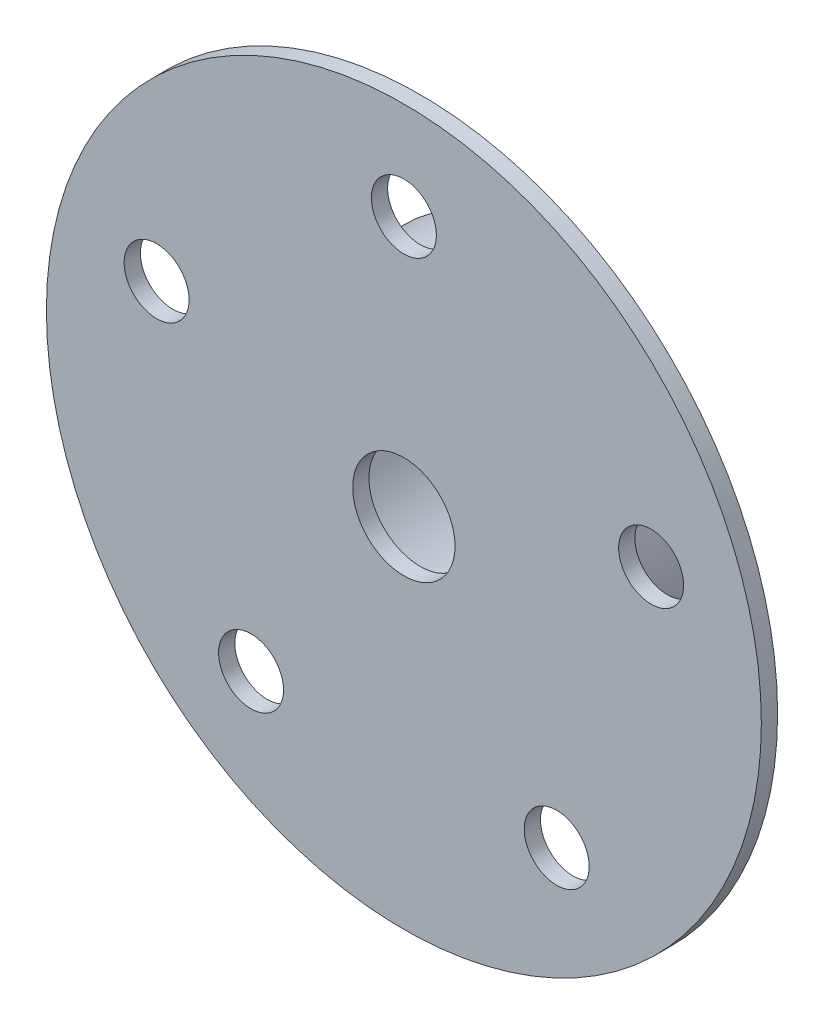
from build123d import *

# Parameters (mm, degrees)
SKETCH_1_R      = 22
SKETCH_1_R_2    = 3.15
SKETCH_1_R_3    = 2
EXTRUDE_1_DEPTH = 1
SKETCH_3_R      = 11
SKETCH_3_R_2    = 7.6
EXTRUDE_2_DEPTH = 7


with BuildPart() as part:
    # 草图1 → 凸台-拉伸1 (new body)
    with BuildSketch(Plane.XY):
        Circle(SKETCH_1_R)
        Circle(SKETCH_1_R_2, mode=Mode.SUBTRACT)
        with Locations((0, 16)):
            Circle(SKETCH_1_R_3, mode=Mode.SUBTRACT)
        with Locations((15.216904261, 4.94427191)):
            Circle(SKETCH_1_R_3, mode=Mode.SUBTRACT)
        with Locations((9.404564037, -12.94427191)):
            Circle(SKETCH_1_R_3, mode=Mode.SUBTRACT)
        with Locations((-9.404564037, -12.94427191)):
            Circle(SKETCH_1_R_3, mode=Mode.SUBTRACT)
        with Locations((-15.216904261, 4.94427191)):
            Circle(SKETCH_1_R_3, mode=Mode.SUBTRACT)
    extrude(amount=EXTRUDE_1_DEPTH)

    # 草图3 → 凸台-拉伸2 (add)
    with BuildSketch(Plane(origin=(0, 0, 0), x_dir=(-1, 0, 0), z_dir=(0, 0, -1))):
        with Locations(Location((0, 0, 0), (0, 0, 180))):
            Circle(SKETCH_3_R)
        Circle(SKETCH_3_R_2, mode=Mode.SUBTRACT)
    extrude(amount=EXTRUDE_2_DEPTH)


solid = part.part
